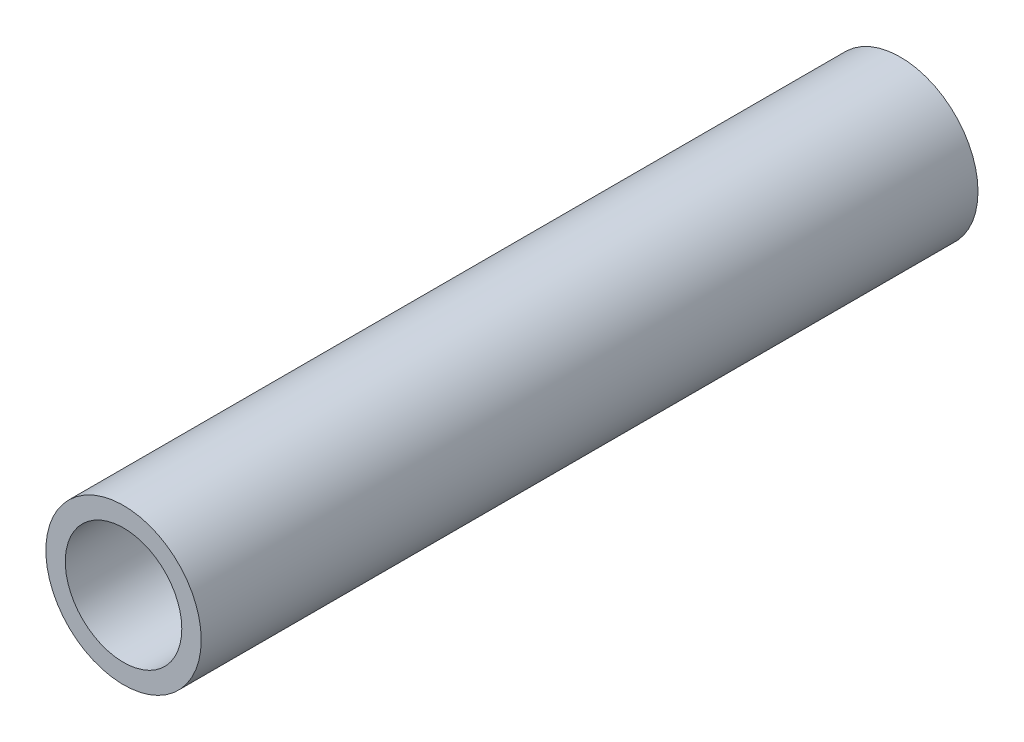
from build123d import *

# Parameters (mm, degrees)
PROFILES_R    = 2
PROFILES_R_2  = 1.5
PROFILE_DEPTH = 10


with BuildPart() as part:
    # ProfileS → Profile (new, symmetric)
    with BuildSketch(Plane.XY):
        Circle(PROFILES_R)
        Circle(PROFILES_R_2, mode=Mode.SUBTRACT)
    extrude(amount=PROFILE_DEPTH, both=True)


solid = part.part
